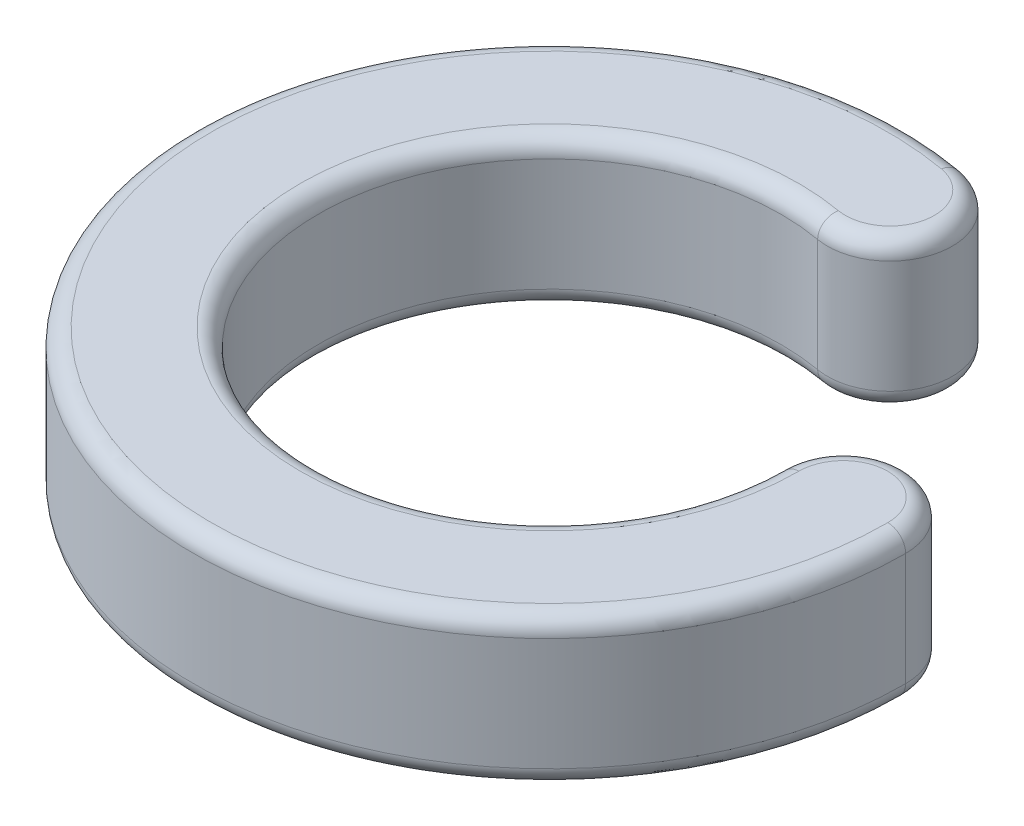
from build123d import *

# Parameters (mm, degrees)
BOSS_EXTRUDE1_DEPTH = 2.5
FILLET2_R           = 0.3
FILLET3_R           = 0.3


with BuildPart() as part:
    # Sketch1 → Boss-Extrude1 (new body)
    with BuildSketch(Plane(origin=(0, 0, 0), x_dir=(1, 0, 0), z_dir=(0, 1, 0))):
        with BuildLine():
            ThreePointArc((3.9, 0), (-2.987573328, -2.506871678), (0.677227893, 3.840750237))
            ThreePointArc((0.677227893, 3.840750237), (1.89360662, 4.692467791), (1.041889066, 5.908846518))
            ThreePointArc((1.041889066, 5.908846518), (-4.596266659, -3.856725658), (6, 0))
            ThreePointArc((6, 0), (4.95, 1.05), (3.9, 0))
        make_face()
    extrude(amount=BOSS_EXTRUDE1_DEPTH)

    # Fillet2
    fillet2_edges = [part.edges().sort_by_distance(p)[0] for p in [
        (1.89360662, 2.5, -4.692467791),
        (-4.596266659, 2.5, 3.856725658),
        (4.95, 2.5, -1.05),
        (-2.987573328, 2.5, 2.506871678),
    ]]
    fillet(fillet2_edges, radius=FILLET2_R)

    # Fillet3
    fillet3_edges = [part.edges().sort_by_distance(p)[0] for p in [
        (-4.596266659, 0, 3.856725658),
        (1.89360662, 0, -4.692467791),
        (-2.987573328, 0, 2.506871678),
        (4.95, 0, -1.05),
    ]]
    fillet(fillet3_edges, radius=FILLET3_R)


solid = part.part
